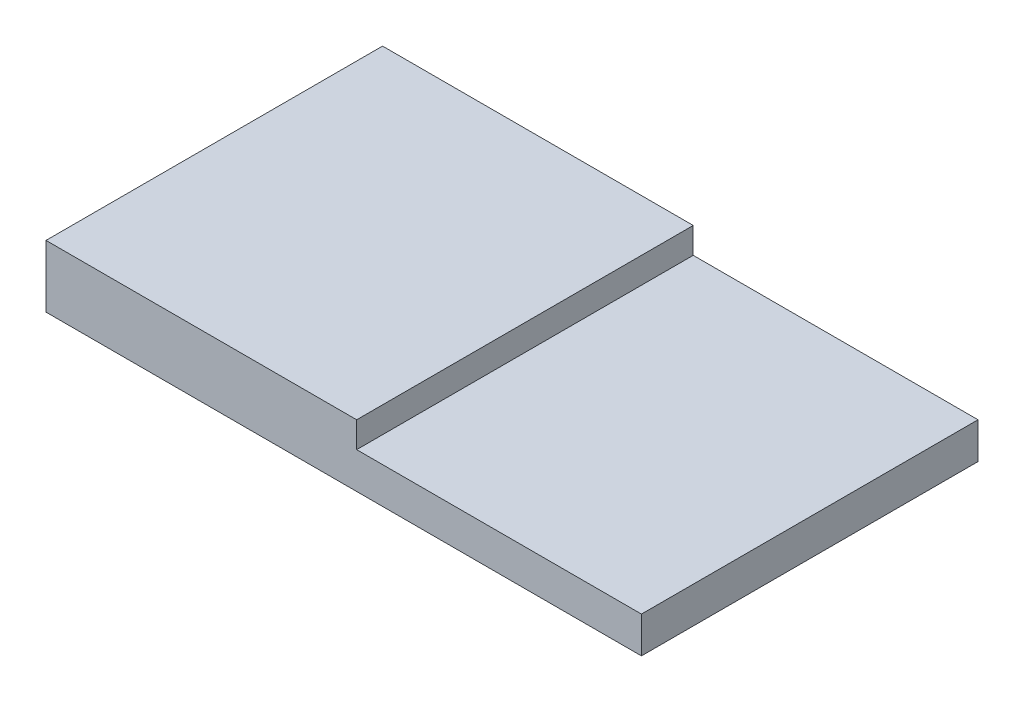
from build123d import *

# Parameters (mm, degrees)
SKETCH_1_W               = 115
SKETCH_1_H               = 65
EXTRUDE_1_DEPTH          = 12
CUT_EXTRUDE_1_DEPTH      = 68.130469982
CUT_EXTRUDE_1_DEPTH_BACK = 68.130469982
SKETCH_3_W               = 55
SKETCH_3_H               = 5


with BuildPart() as part:
    # 스케치1 → 보스-돌출1 (new body)
    with BuildSketch(Plane(origin=(0, 0, 0), x_dir=(1, 0, 0), z_dir=(0, 1, 0))):
        Rectangle(SKETCH_1_W, SKETCH_1_H)
    extrude(amount=EXTRUDE_1_DEPTH)

    # 스케치3 → 컷-돌출1 (cut, two sides: drawn at the far end of the back side and taken through both)
    with BuildSketch(Plane.XY.offset(-CUT_EXTRUDE_1_DEPTH_BACK)):
        with Locations((30, 9.5)):
            Rectangle(SKETCH_3_W, SKETCH_3_H)
    extrude(amount=CUT_EXTRUDE_1_DEPTH + CUT_EXTRUDE_1_DEPTH_BACK, mode=Mode.SUBTRACT)


solid = part.part
